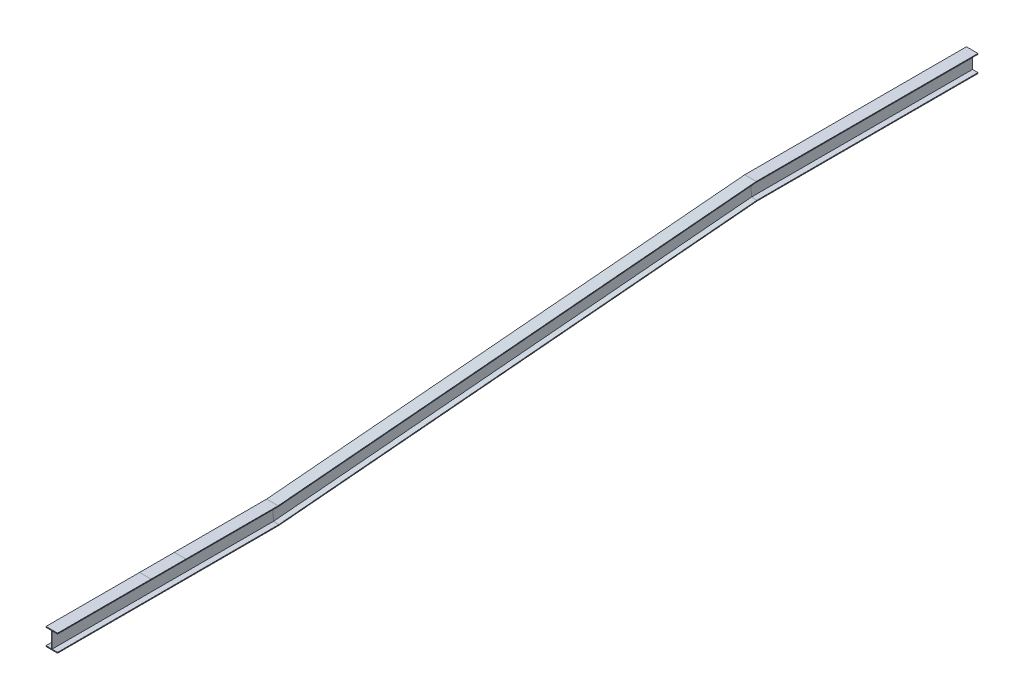
from build123d import *

# Parameters (mm, degrees)
BOSS_EXTRUDE1_DEPTH = 14.541598669
BOSS_EXTRUDE2_DEPTH = 11.109177684


with BuildPart() as part:
    # Sweep1: sweep along a path in Sketch2
    with BuildLine(Plane(origin=(0, 0, 0), x_dir=(0, 0, -1), z_dir=(1, 0, 0))) as sweep1_path:
        Line((0, -76.581240533), (1930, -76.581240533))
        Line((1930, -76.581240533), (6128.777671415, 290.764206382))
        Line((6128.777671415, 290.764206382), (8058.777671415, 290.764206382))
    # Sketch1 → Sweep1 (sweep)
    with BuildSketch(Plane.XY):
        Polygon((0, -0.000240533), (101.6, -0.000240533), (101.6, -7.112240533), (53.408035714, -7.112240533), (53.408035714, -146.050240533), (101.6, -146.050240533), (101.6, -153.162240533), (0, -153.162240533), (0, -146.050240533), (47.566035714, -146.050240533), (47.566035714, -7.112240533), (0, -7.112240533), align=None)
    sweep(path=sweep1_path.line, transition=Transition.RIGHT)

    # Sketch4 → Boss-Extrude1 (add)
    with BuildSketch(Plane(origin=(0, 0, -8058.777671415), x_dir=(-1, 0, 0), z_dir=(0, 0, -1))):
        Polygon((0, 360.233206382), (0, 367.345206382), (-101.6, 367.345206382), (-101.6, 360.233206382), (-53.408035714, 360.233206382), (-53.408035714, 221.295206382), (-101.6, 221.295206382), (-101.6, 214.183206382), (0, 214.183206382), (0, 221.295206382), (-47.566035714, 221.295206382), (-47.566035714, 360.233206382), align=None)
    extrude(amount=BOSS_EXTRUDE1_DEPTH)

    # Sketch5 → Boss-Extrude2 (add)
    with BuildSketch(Plane.XY):
        Polygon((0, -0.000240533), (0, -7.112240533), (47.566035714, -7.112240533), (47.566035714, -146.050240533), (0, -146.050240533), (0, -153.162240533), (101.6, -153.162240533), (101.6, -146.050240533), (53.408035714, -146.050240533), (53.408035714, -7.112240533), (101.6, -7.112240533), (101.6, -0.000240533), align=None)
    extrude(amount=BOSS_EXTRUDE2_DEPTH)


solid = part.part
